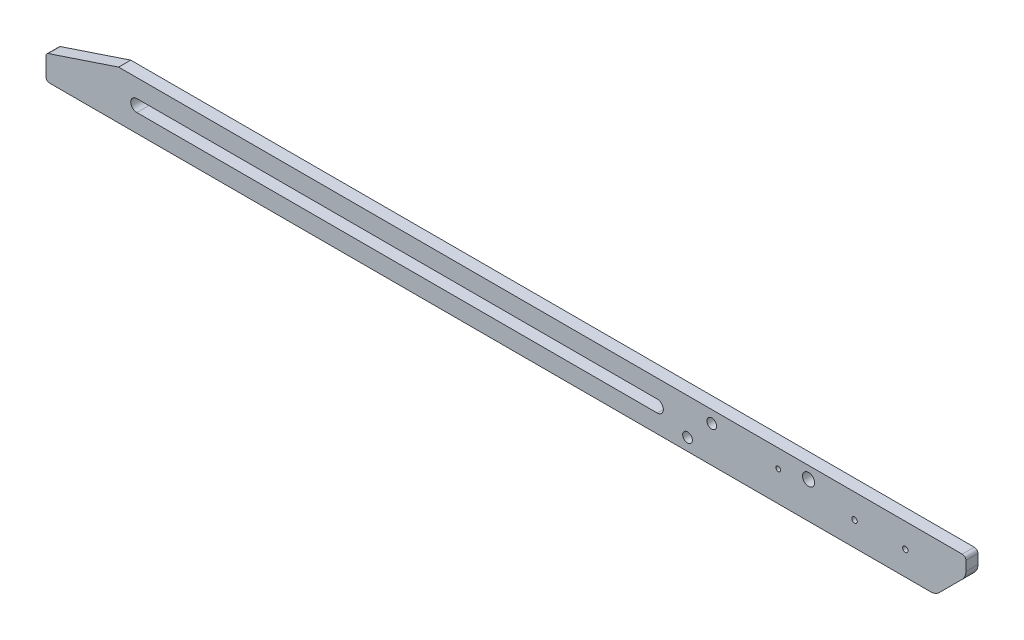
from build123d import *

# Parameters (mm, degrees)
ESQUISSE1_W                  = 760
ESQUISSE1_H                  = 40
BOSS_EXTRU_1_DEPTH           = 10
ENL_V_MAT_EXTRU_1_DEPTH      = 762.117599324
ENL_V_MAT_EXTRU_1_DEPTH_BACK = 762.117599324
ENL_V_MAT_EXTRU_2_DEPTH      = 762.117599324
ENL_V_MAT_EXTRU_2_DEPTH_BACK = 762.117599324
ENL_V_MAT_EXTRU_3_DEPTH      = 762.117599324
ENL_V_MAT_EXTRU_3_DEPTH_BACK = 762.117599324
ESQUISSE4_R                  = 4
CONG_1_R                     = 3
CHANFREIN1_SIZE              = 25
ENL_V_MAT_EXTRU_4_DEPTH      = 762.117599324
ENL_V_MAT_EXTRU_4_DEPTH_BACK = 762.117599324
ESQUISSE5_R                  = 2.25
ESQUISSE5_R_2                = 5
ESQUISSE5_R_3                = 2
CONG_2_R                     = 3
CONG_3_R                     = 10


with BuildPart() as part:
    # Esquisse1 → Boss.-Extru.1 (new body)
    with BuildSketch(Plane.XY):
        with Locations((380, 20)):
            Rectangle(ESQUISSE1_W, ESQUISSE1_H)
    extrude(amount=BOSS_EXTRU_1_DEPTH)

    # Esquisse2 → Enlèv. mat.-Extru.1 (cut, two sides: drawn at the far end of the back side and taken through both)
    with BuildSketch(Plane.XY.offset(10).offset(-ENL_V_MAT_EXTRU_1_DEPTH_BACK)):
        Polygon((0, 40), (60, 40), (0, 20), align=None)
    extrude(amount=ENL_V_MAT_EXTRU_1_DEPTH + ENL_V_MAT_EXTRU_1_DEPTH_BACK, mode=Mode.SUBTRACT)

    # Esquisse3 → Enlèv. mat.-Extru.2 (cut, two sides: drawn at the far end of the back side and taken through both)
    with BuildSketch(Plane.XY.offset(10).offset(-ENL_V_MAT_EXTRU_2_DEPTH_BACK)):
        with BuildLine():
            Line((75, 25), (505, 25))
            ThreePointArc((505, 25), (510, 20), (505, 15))
            Line((505, 15), (75, 15))
            ThreePointArc((75, 15), (70, 20), (75, 25))
        make_face()
    extrude(amount=ENL_V_MAT_EXTRU_2_DEPTH + ENL_V_MAT_EXTRU_2_DEPTH_BACK, mode=Mode.SUBTRACT)

    # Esquisse4 → Enlèv. mat.-Extru.3 (cut, two sides: drawn at the far end of the back side and taken through both)
    with BuildSketch(Plane.XY.offset(10).offset(-ENL_V_MAT_EXTRU_3_DEPTH_BACK)):
        with Locations(Location((530, 10, 0), (0, 0, 180))):
            Circle(ESQUISSE4_R)
        with Locations(Location((550, 30, 0), (0, 0, 180))):
            Circle(ESQUISSE4_R)
    extrude(amount=ENL_V_MAT_EXTRU_3_DEPTH + ENL_V_MAT_EXTRU_3_DEPTH_BACK, mode=Mode.SUBTRACT)

    # Congé1
    cong_1_edges = [part.edges().sort_by_distance(p)[0] for p in [
        (0, 20, 5),
        (0, 0, 5),
    ]]
    fillet(cong_1_edges, radius=CONG_1_R)

    # Chanfrein1
    chanfrein1_edges = [part.edges().sort_by_distance(p)[0] for p in [
        (760, 0, 5),
    ]]
    chamfer(chanfrein1_edges, length=CHANFREIN1_SIZE)

    # Esquisse5 → Enlèv. mat.-Extru.4 (cut, two sides: drawn at the far end of the back side and taken through both)
    with BuildSketch(Plane.XY.offset(10).offset(-ENL_V_MAT_EXTRU_4_DEPTH_BACK)):
        with Locations(Location((710, 20, 0), (0, 0, 180))):
            Circle(ESQUISSE5_R)
        with Locations(Location((668, 20, 0), (0, 0, 180))):
            Circle(ESQUISSE5_R)
        with Locations(Location((630, 30, 0), (0, 0, 180))):
            Circle(ESQUISSE5_R_2)
        with Locations(Location((605, 25, 0), (0, 0, 180))):
            Circle(ESQUISSE5_R_3)
    extrude(amount=ENL_V_MAT_EXTRU_4_DEPTH + ENL_V_MAT_EXTRU_4_DEPTH_BACK, mode=Mode.SUBTRACT)

    # Congé2
    cong_2_edges = [part.edges().sort_by_distance(p)[0] for p in [
        (760, 40, 5),
    ]]
    fillet(cong_2_edges, radius=CONG_2_R)

    # Congé3
    cong_3_edges = [part.edges().sort_by_distance(p)[0] for p in [
        (760, 25, 5),
        (735, 0, 5),
    ]]
    fillet(cong_3_edges, radius=CONG_3_R)


solid = part.part
